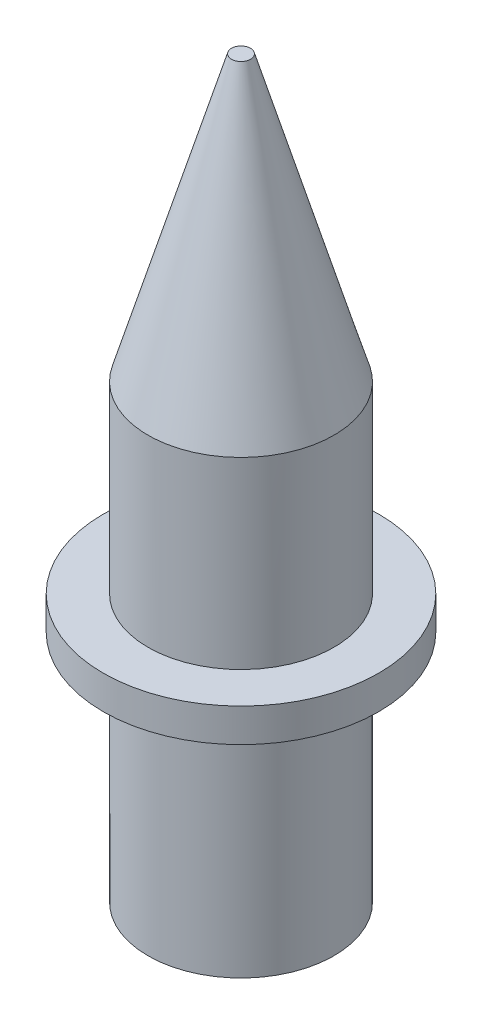
from build123d import *

# Parameters (mm, degrees)
SKETCH1_R           = 5.57
BOSS_EXTRUDE1_DEPTH = 44
CHAMFER1_SIZE       = 17
CHAMFER1_SIZE2      = 5
SKETCH2_R           = 8.25
BOSS_EXTRUDE2_DEPTH = 2


with BuildPart() as part:
    # Sketch1 → Boss-Extrude1 (new body)
    with BuildSketch(Plane(origin=(0, 0, 0), x_dir=(1, 0, 0), z_dir=(0, 1, 0))):
        with Locations(Location((0, 0, 0), (0, 0, 270))):
            Circle(SKETCH1_R)
    extrude(amount=BOSS_EXTRUDE1_DEPTH)

    # Chamfer1
    chamfer1_edges = [part.edges().sort_by_distance(p)[0] for p in [
        (0, 44, -5.57),
    ]]
    chamfer1_side = [part.faces().sort_by_distance(p)[0] for p in [
        (0, 22, -5.57),
    ]]
    chamfer(chamfer1_edges, length=CHAMFER1_SIZE, length2=CHAMFER1_SIZE2, reference=chamfer1_side[0])

    # Sketch2 → Boss-Extrude2 (add)
    with BuildSketch(Plane(origin=(0, 16, 0), x_dir=(1, 0, 0), z_dir=(0, 1, 0))):
        with Locations(Location((0, 0, 0), (0, 0, 270))):
            Circle(SKETCH2_R)
    extrude(amount=-BOSS_EXTRUDE2_DEPTH)


solid = part.part
